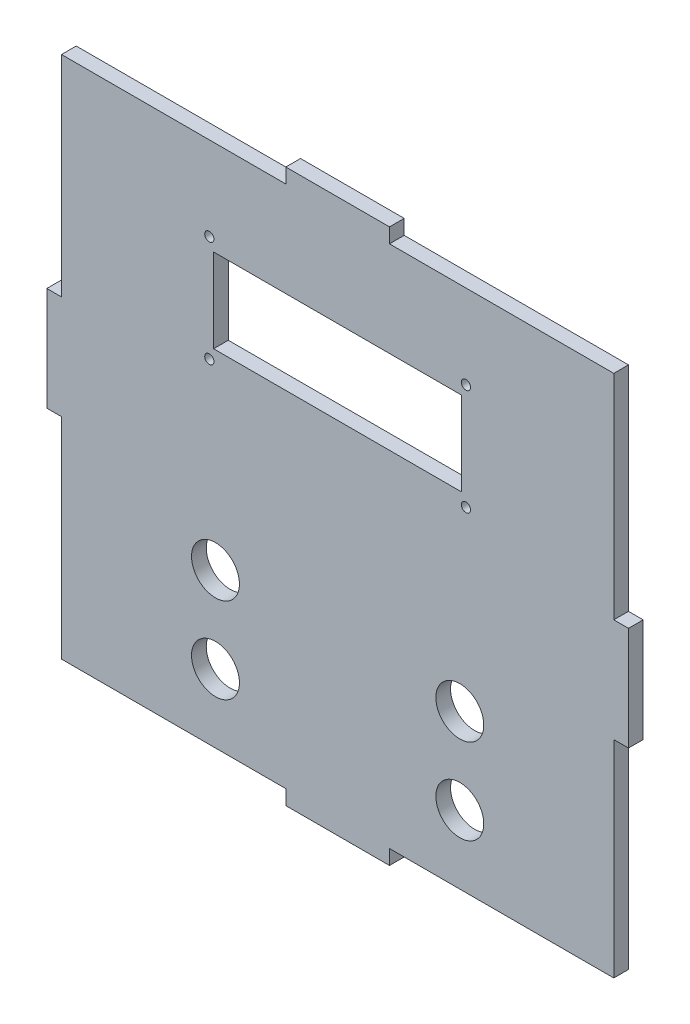
from build123d import *

# Parameters (mm, degrees)
SKETCH1_R           = 7
SKETCH1_R_2         = 1.35
SKETCH1_W           = 72.5
SKETCH1_H           = 24.5
BOSS_EXTRUDE1_DEPTH = 4.3


with BuildPart() as part:
    # Sketch1 → Boss-Extrude1 (new body)
    with BuildSketch(Plane.XY):
        Polygon((15.15, 76.515), (80.7, 76.515), (80.7, 14.135), (85, 14.135), (85, -16.165), (80.7, -16.165), (80.7, -76.515), (15.15, -76.515), (15.15, -80.815), (-15.15, -80.815), (-15.15, -76.515), (-80.7, -76.515), (-80.7, -15.15), (-85, -15.15), (-85, 15.15), (-80.7, 15.15), (-80.7, 76.515), (-15.15, 76.515), (-15.15, 80.815), (15.15, 80.815), align=None)
        with Locations(Location((35.7, -31.515, 0), (0, 0, 180))):
            Circle(SKETCH1_R, mode=Mode.SUBTRACT)
        with Locations(Location((35.7, -56.515, 0), (0, 0, 180))):
            Circle(SKETCH1_R, mode=Mode.SUBTRACT)
        with Locations(Location((-35.7, -56.515, 0), (0, 0, 180))):
            Circle(SKETCH1_R, mode=Mode.SUBTRACT)
        with Locations(Location((-35.7, -31.515, 0), (0, 0, 180))):
            Circle(SKETCH1_R, mode=Mode.SUBTRACT)
        with Locations(Location((-37.5, 52.015, 0), (0, 0, 180))):
            Circle(SKETCH1_R_2, mode=Mode.SUBTRACT)
        with Locations(Location((-37.5, 21.015, 0), (0, 0, 180))):
            Circle(SKETCH1_R_2, mode=Mode.SUBTRACT)
        with Locations(Location((37.5, 21.015, 0), (0, 0, 180))):
            Circle(SKETCH1_R_2, mode=Mode.SUBTRACT)
        with Locations(Location((37.5, 52.015, 0), (0, 0, 180))):
            Circle(SKETCH1_R_2, mode=Mode.SUBTRACT)
        with Locations((0, 36.515)):
            Rectangle(SKETCH1_W, SKETCH1_H, mode=Mode.SUBTRACT)
    extrude(amount=BOSS_EXTRUDE1_DEPTH)


solid = part.part
